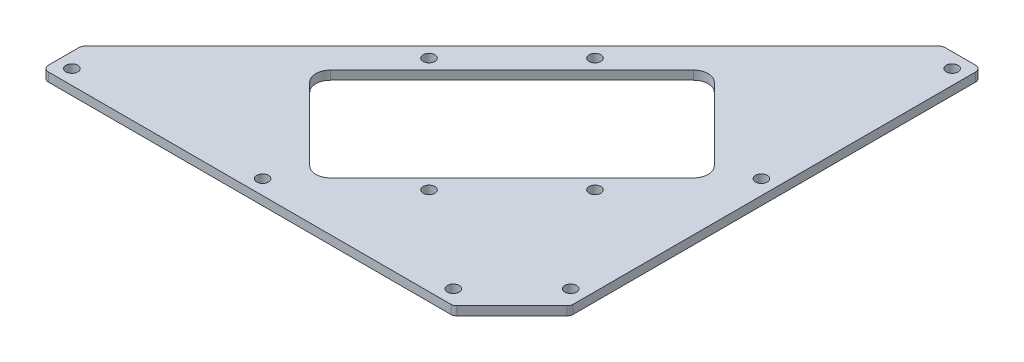
from build123d import *

# Parameters (mm, degrees)
SKETCH_1_R      = 2
EXTRUDE_1_DEPTH = 3
FILLET_1_R      = 2
FILLET_2_R      = 5


with BuildPart() as part:
    # ｽｹｯﾁ1 → ﾎﾞｽ - 押し出し1 (new body)
    with BuildSketch(Plane(origin=(0, 0, 0), x_dir=(1, 0, 0), z_dir=(0, 1, 0))):
        Polygon((0, 20), (0, 160), (-10, 160), (-13.241161391, 160), (-45.078057301, 128.16310409), (-128.16310409, 45.078057301), (-160, 13.241161391), (-160, 10), (-160, 0), (-20, 0), align=None)
        with Locations(Location((-5, 25, 0), (0, 0, 270))):
            Circle(SKETCH_1_R, mode=Mode.SUBTRACT)
        with Locations(Location((-5, 90, 0), (0, 0, 270))):
            Circle(SKETCH_1_R, mode=Mode.SUBTRACT)
        with Locations(Location((-90, 5, 0), (0, 0, 270))):
            Circle(SKETCH_1_R, mode=Mode.SUBTRACT)
        with Locations(Location((-25, 5, 0), (0, 0, 270))):
            Circle(SKETCH_1_R, mode=Mode.SUBTRACT)
        with Locations(Location((-68.942911166, 97.227182413, 0), (0, 0, 270))):
            Circle(SKETCH_1_R, mode=Mode.SUBTRACT)
        with Locations(Location((-30.0520382, 58.336309448, 0), (0, 0, 270))):
            Circle(SKETCH_1_R, mode=Mode.SUBTRACT)
        with Locations(Location((-58.336309448, 30.0520382, 0), (0, 0, 270))):
            Circle(SKETCH_1_R, mode=Mode.SUBTRACT)
        with Locations(Location((-97.227182413, 68.942911166, 0), (0, 0, 270))):
            Circle(SKETCH_1_R, mode=Mode.SUBTRACT)
        with Locations(Location((-5, 155, 0), (0, 0, 270))):
            Circle(SKETCH_1_R, mode=Mode.SUBTRACT)
        with Locations(Location((-155, 5, 0), (0, 0, 270))):
            Circle(SKETCH_1_R, mode=Mode.SUBTRACT)
        Polygon((-82.201163313, 13.258252147), (-13.258252147, 82.201163313), (-45.078057301, 114.020968466), (-114.020968466, 45.078057301), align=None, mode=Mode.SUBTRACT)
    extrude(amount=EXTRUDE_1_DEPTH)

    # ﾌｨﾚｯﾄ1
    fillet_1_edges = [part.edges().sort_by_distance(p)[0] for p in [
        (-13.241161391, 1.5, -160),
        (0, 1.5, -160),
        (0, 1.5, -20),
        (-20, 1.5, 0),
        (-160, 1.5, 0),
        (-160, 1.5, -13.241161391),
    ]]
    fillet(fillet_1_edges, radius=FILLET_1_R)

    # ﾌｨﾚｯﾄ2
    fillet_2_edges = [part.edges().sort_by_distance(p)[0] for p in [
        (-82.201163313, 1.5, -13.258252147),
        (-13.258252147, 1.5, -82.201163313),
        (-45.078057301, 1.5, -114.020968466),
        (-114.020968466, 1.5, -45.078057301),
    ]]
    fillet(fillet_2_edges, radius=FILLET_2_R)


solid = part.part
